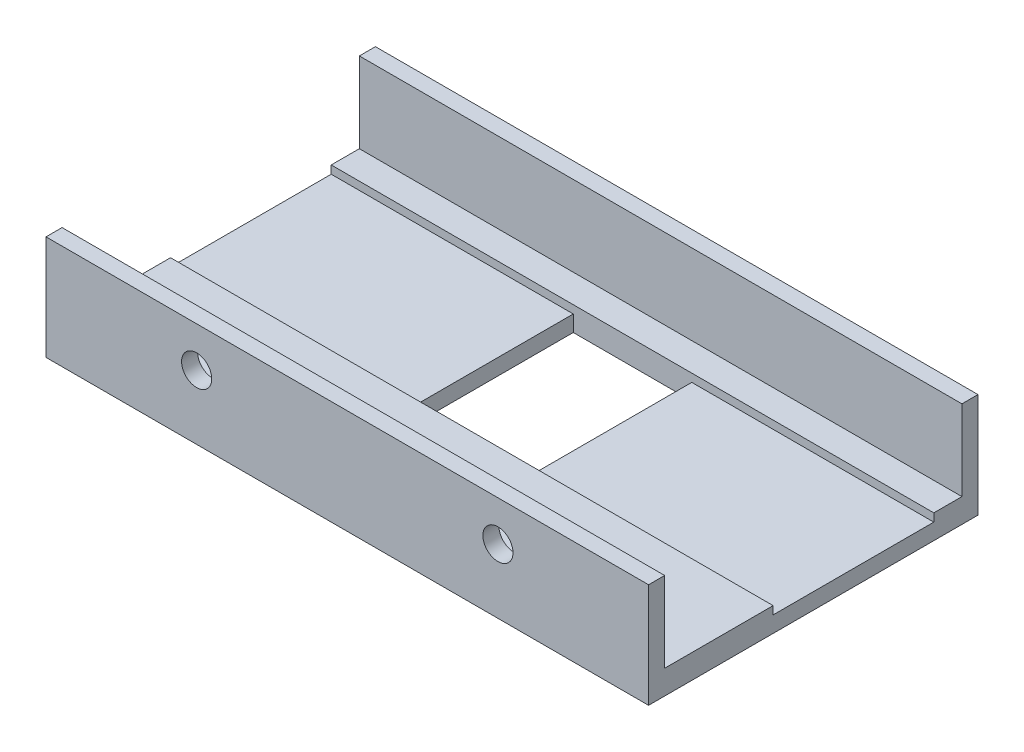
from build123d import *

# Parameters (mm, degrees)
SKETCH1_W           = 75
SKETCH1_H           = 41
BOSS_EXTRUDE1_DEPTH = 3
SKETCH2_W           = 75
SKETCH2_H           = 2
BOSS_EXTRUDE2_DEPTH = 10
SKETCH3_W           = 75
SKETCH3_H           = 2
BOSS_EXTRUDE3_DEPTH = 10
SKETCH4_OUTSIDE_W   = 94.292
SKETCH4_OUTSIDE_H   = 32.292
SKETCH4_OUTSIDE_W_2 = 79
SKETCH4_OUTSIDE_H_2 = 17
SKETCH4_OUTSIDE_R   = 1.875
CUT_EXTRUDE2_DEPTH  = 2
SKETCH6_W           = 14.75
SKETCH6_H           = 20
CUT_EXTRUDE3_DEPTH  = 44.891912695
SKETCH7_W           = 75
SKETCH7_H           = 20
CUT_EXTRUDE4_DEPTH  = 1


with BuildPart() as part:
    # Sketch1 → Boss-Extrude1 (new body)
    with BuildSketch(Plane(origin=(0, 0, 0), x_dir=(1, 0, 0), z_dir=(0, 1, 0))):
        Rectangle(SKETCH1_W, SKETCH1_H)
    extrude(amount=BOSS_EXTRUDE1_DEPTH)

    # Sketch2 → Boss-Extrude2 (add)
    with BuildSketch(Plane(origin=(0, 3, 0), x_dir=(1, 0, 0), z_dir=(0, 1, 0))):
        with Locations((0, 19.5)):
            Rectangle(SKETCH2_W, SKETCH2_H)
    extrude(amount=BOSS_EXTRUDE2_DEPTH)

    # Sketch3 → Boss-Extrude3 (add)
    with BuildSketch(Plane(origin=(0, 3, 0), x_dir=(1, 0, 0), z_dir=(0, 1, 0))):
        with Locations((0, -19.5)):
            Rectangle(SKETCH3_W, SKETCH3_H)
    extrude(amount=BOSS_EXTRUDE3_DEPTH)

    # Sketch4 outside → Cut-Extrude2 (cut)
    # profile 1 of 3: a face of its own
    with BuildSketch(Plane.XY.offset(20.5)):
        with Locations((0, 6.5)):
            Rectangle(SKETCH4_OUTSIDE_W, SKETCH4_OUTSIDE_H)
        with Locations((0, 6.5)):
            Rectangle(SKETCH4_OUTSIDE_W_2, SKETCH4_OUTSIDE_H_2, mode=Mode.SUBTRACT)
    # profile 2 of 3: a face of its own
    with BuildSketch(Plane.XY.offset(20.5)):
        with Locations((18.75, 8)):
            Circle(SKETCH4_OUTSIDE_R)
    # profile 3 of 3: a face of its own
    with BuildSketch(Plane.XY.offset(20.5)):
        with Locations((-18.75, 8)):
            Circle(SKETCH4_OUTSIDE_R)
    extrude(amount=-CUT_EXTRUDE2_DEPTH, mode=Mode.SUBTRACT)

    # Sketch6 → Cut-Extrude3 (cut, through all)
    with BuildSketch(Plane(origin=(0, 3, 0), x_dir=(1, 0, 0), z_dir=(0, 1, 0))):
        with Locations((0, 5)):
            Rectangle(SKETCH6_W, SKETCH6_H)
    extrude(amount=-CUT_EXTRUDE3_DEPTH, mode=Mode.SUBTRACT)

    # Sketch7 → Cut-Extrude4 (cut)
    with BuildSketch(Plane(origin=(0, 3, 0), x_dir=(1, 0, 0), z_dir=(0, 1, 0))):
        with Locations((0, 5)):
            Rectangle(SKETCH7_W, SKETCH7_H)
    extrude(amount=-CUT_EXTRUDE4_DEPTH, mode=Mode.SUBTRACT)


solid = part.part
